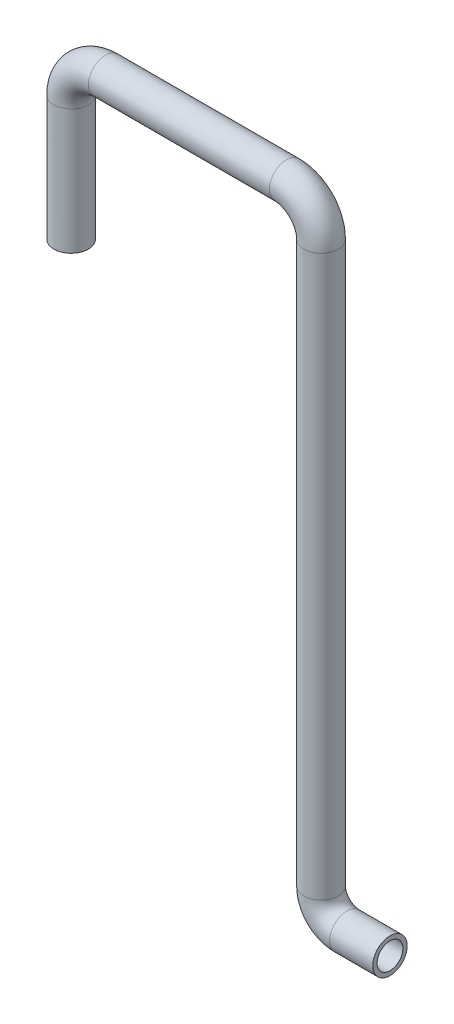
from build123d import *

# Parameters (mm, degrees)
TUBE_PROFILE_R   = 4
TUBE_PROFILE_R_2 = 3


with BuildPart() as part:
    # Tube: sweep along a curve in space
    with BuildLine() as tube_path:
        Line((14, 128, 95), (14, 157, 95))
        ThreePointArc((22, 165, 95), (16.343145751, 162.656854249, 95), (14, 157, 95))
        Line((22, 165, 95), (64, 165, 95))
        ThreePointArc((72, 157, 95), (69.656854249, 162.656854249, 95), (64, 165, 95))
        Line((72, 157, 95), (72, 27, 95))
        ThreePointArc((78, 21, 95), (73.757359313, 22.757359313, 95), (72, 27, 95))
        Line((78, 21, 95), (88, 21, 95))
    # Tube profile (on start of the path) → Tube (sweep)
    with BuildSketch(Plane(origin=(14, 128, 95), x_dir=(1, 0, 0), z_dir=(0, 1, 0))):
        Circle(TUBE_PROFILE_R)
        Circle(TUBE_PROFILE_R_2, mode=Mode.SUBTRACT)
    sweep(path=tube_path.line)


solid = part.part
